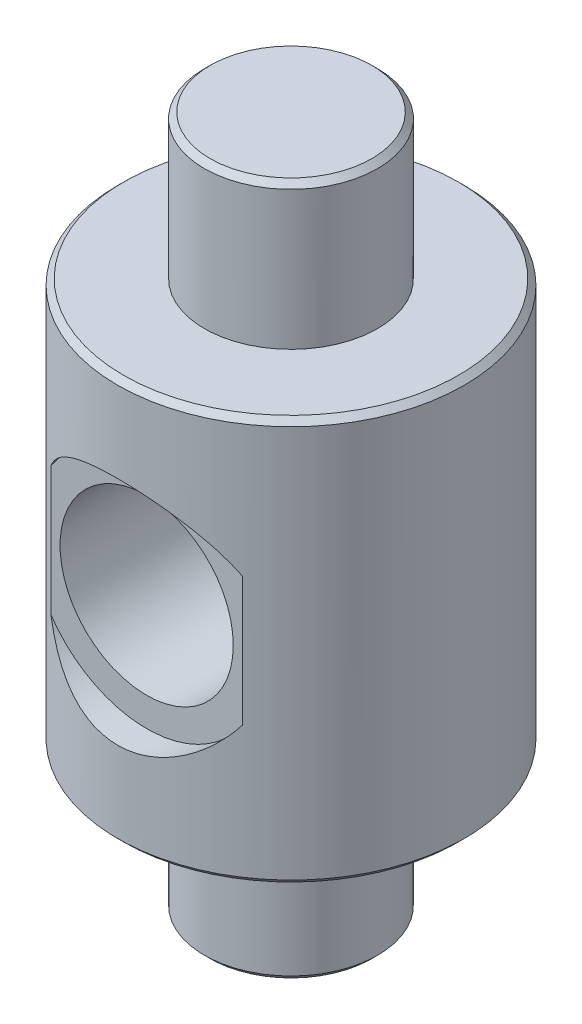
from build123d import *

# Parameters (mm, degrees)
SKETCH3_R          = 2
CUT_EXTRUDE2_DEPTH = 0.5
SKETCH5_R          = 1.5
CUT_EXTRUDE3_DEPTH = 14.536986433
CHAMFER1_SIZE      = 0.1


with BuildPart() as part:
    # Sketch2 → Revolve1 (revolve)
    with BuildSketch(Plane.XY, mode=Mode.PRIVATE) as revolve1_sk:
        Polygon((0, 0), (0, 12), (1.5, 12), (1.5, 9.5), (3, 9.5), (3, 2.5), (1.5, 2.5), (1.5, 0), align=None)
    revolve(revolve1_sk.sketch.rotate(Axis((0, 0, 0), (0, 1, 0)), 90), axis=Axis((0, 0, 0), (0, 1, 0)))

    # Sketch3 → Cut-Extrude2 (cut)
    with BuildSketch(Plane.XY.offset(3)):
        with Locations((0, 6)):
            Circle(SKETCH3_R)
    cut_extrude2 = extrude(amount=-CUT_EXTRUDE2_DEPTH, mode=Mode.SUBTRACT)

    # Mirror1: Cut-Extrude2 across plane
    add(cut_extrude2.mirror(Plane.XY), mode=Mode.SUBTRACT)

    # Sketch5 → Cut-Extrude3 (cut, through all)
    with BuildSketch(Plane.XY.offset(2.5)):
        with Locations((0, 6)):
            Circle(SKETCH5_R)
    extrude(amount=-CUT_EXTRUDE3_DEPTH, mode=Mode.SUBTRACT)

    # Chamfer1
    chamfer1_edges = [part.edges().sort_by_distance(p)[0] for p in [
        (0, 0, 1.5),
        (0, 2.5, 3),
        (0, 9.5, 3),
        (0, 12, 1.5),
    ]]
    chamfer(chamfer1_edges, length=CHAMFER1_SIZE)


solid = part.part
